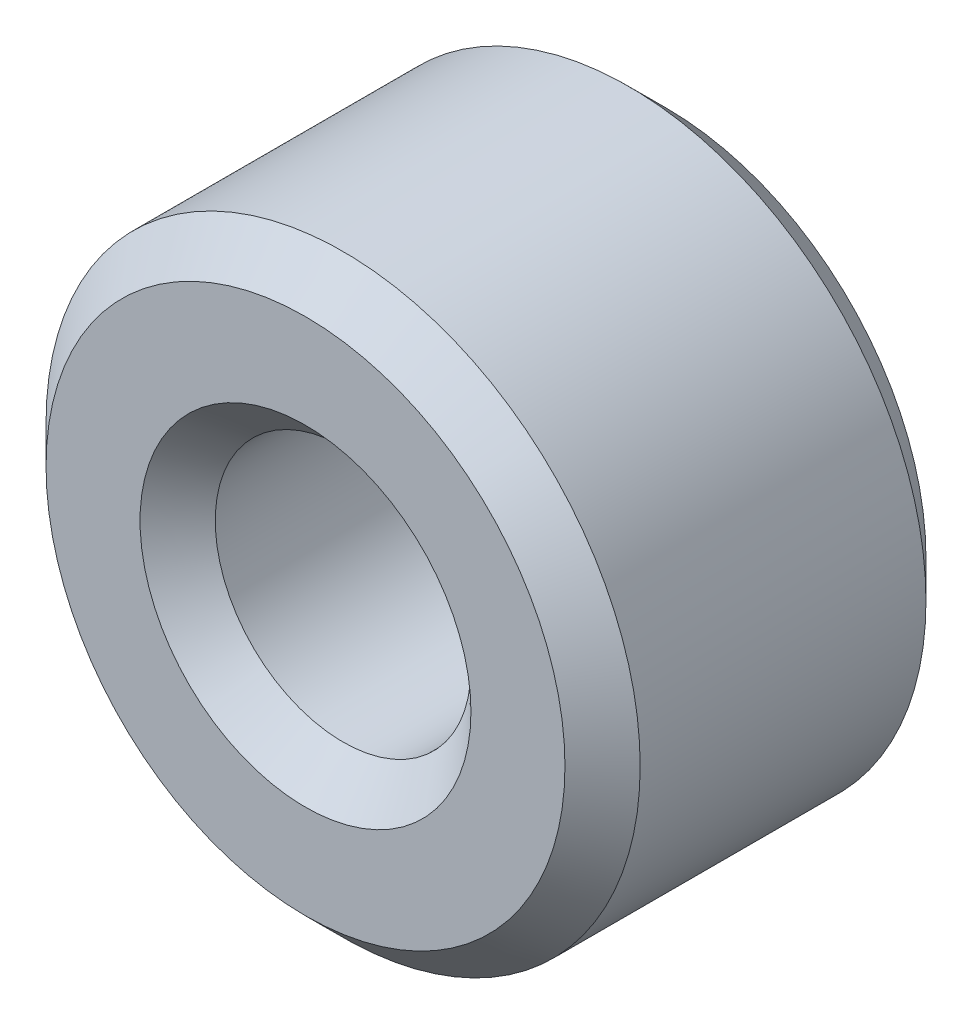
from build123d import *

# Parameters (mm, degrees)
CROQUIS1_R              = 3.95
CROQUIS1_R_2            = 1.7
SALIENTE_EXTRUIR1_DEPTH = 4.8
CHAFL_N1_SIZE           = 0.5


with BuildPart() as part:
    # Croquis1 → Saliente-Extruir1 (new body)
    with BuildSketch(Plane.XY):
        with Locations((-7.600000242, 9.362000442)):
            Circle(CROQUIS1_R)
        with Locations((-7.600000242, 9.362000442)):
            Circle(CROQUIS1_R_2, mode=Mode.SUBTRACT)
    extrude(amount=SALIENTE_EXTRUIR1_DEPTH)

    # Chaflán1
    chafl_n1_edges = [part.edges().sort_by_distance(p)[0] for p in [
        (-11.550000242, 9.362000442, 0),
        (-11.550000242, 9.362000442, 4.8),
        (-9.300000242, 9.362000442, 0),
        (-9.300000242, 9.362000442, 4.8),
    ]]
    chamfer(chafl_n1_edges, length=CHAFL_N1_SIZE)


solid = part.part
